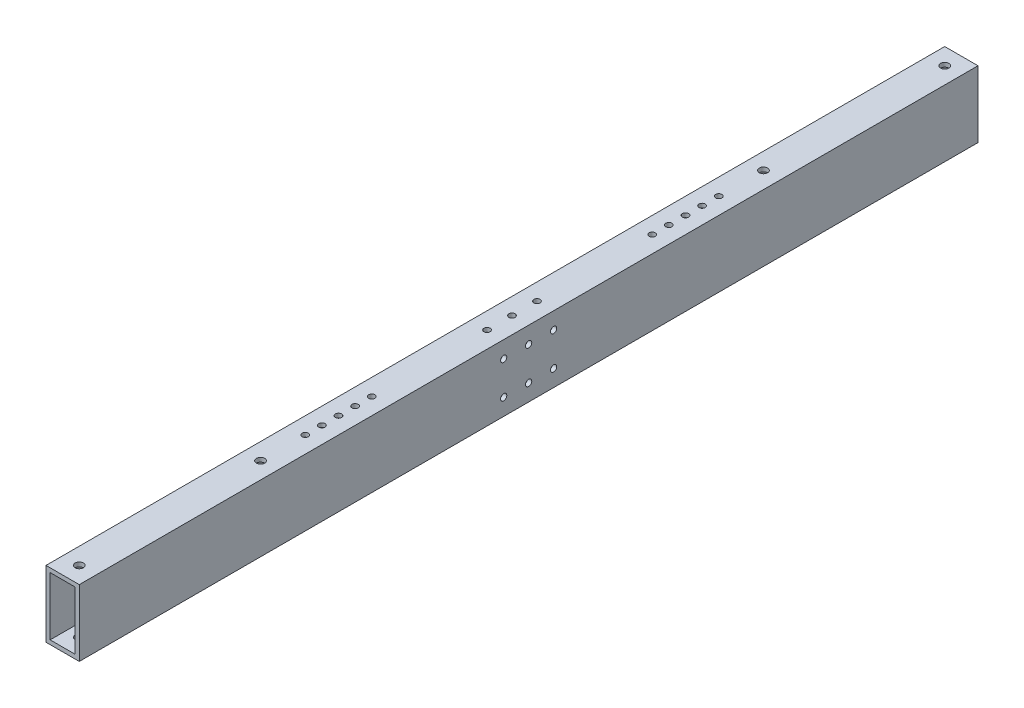
from build123d import *

# Parameters (mm, degrees)
SKETCH1_W           = 25.4
SKETCH1_H           = 50.8
SKETCH1_W_2         = 19.05
SKETCH1_H_2         = 44.45
BOSS_EXTRUDE1_DEPTH = 685.8
SKETCH2_R           = 3.175
SKETCH2_R_2         = 2.38125
CUT_EXTRUDE1_DEPTH  = 688.796168934
SKETCH3_R           = 2.38125
CUT_EXTRUDE2_DEPTH  = 3.175
SKETCH4_R           = 2.38125
CUT_EXTRUDE3_DEPTH  = 688.796168934


with BuildPart() as part:
    # Sketch1 → Boss-Extrude1 (new body)
    with BuildSketch(Plane.XY):
        Rectangle(SKETCH1_W, SKETCH1_H)
        Rectangle(SKETCH1_W_2, SKETCH1_H_2, mode=Mode.SUBTRACT)
    extrude(amount=BOSS_EXTRUDE1_DEPTH)

    # Sketch2 → Cut-Extrude1 (cut, through all)
    with BuildSketch(Plane(origin=(0, 25.4, 0), x_dir=(1, 0, 0), z_dir=(0, 1, 0))):
        with Locations(Location((0, -12.7, 0), (0, 0, 270))):
            Circle(SKETCH2_R)
        with Locations(Location((0, -151.012144, 0), (0, 0, 270))):
            Circle(SKETCH2_R)
        with Locations((0, -534.787856)):
            Circle(SKETCH2_R)
        with Locations((0, -673.1)):
            Circle(SKETCH2_R)
        with Locations(Location((0, -185.1062846, 0), (0, 0, 270))):
            Circle(SKETCH2_R_2)
        with Locations(Location((0, -197.8062846, 0), (0, 0, 270))):
            Circle(SKETCH2_R_2)
        with Locations(Location((0, -210.5062846, 0), (0, 0, 270))):
            Circle(SKETCH2_R_2)
        with Locations(Location((0, -223.2062846, 0), (0, 0, 270))):
            Circle(SKETCH2_R_2)
        with Locations(Location((0, -235.9062846, 0), (0, 0, 270))):
            Circle(SKETCH2_R_2)
        with Locations((0, -449.8937154)):
            Circle(SKETCH2_R_2)
        with Locations((0, -462.5937154)):
            Circle(SKETCH2_R_2)
        with Locations((0, -475.2937154)):
            Circle(SKETCH2_R_2)
        with Locations((0, -487.9937154)):
            Circle(SKETCH2_R_2)
        with Locations((0, -500.6937154)):
            Circle(SKETCH2_R_2)
    extrude(amount=-CUT_EXTRUDE1_DEPTH, mode=Mode.SUBTRACT)

    # Sketch3 → Cut-Extrude2 (cut)
    with BuildSketch(Plane(origin=(12.7, 0, 0), x_dir=(0, 0, -1), z_dir=(1, 0, 0))):
        with Locations((-361.95, -12.7)):
            Circle(SKETCH3_R)
        with Locations((-342.9, -12.7)):
            Circle(SKETCH3_R)
        with Locations(Location((-323.85, -12.7, 0), (0, 0, 180))):
            Circle(SKETCH3_R)
        with Locations((-323.85, 12.7)):
            Circle(SKETCH3_R)
        with Locations(Location((-361.95, 12.7, 0), (0, 0, 180))):
            Circle(SKETCH3_R)
        with Locations(Location((-342.9, 12.7, 0), (0, 0, 180))):
            Circle(SKETCH3_R)
    extrude(amount=-CUT_EXTRUDE2_DEPTH, mode=Mode.SUBTRACT)

    # Sketch4 → Cut-Extrude3 (cut, through all)
    with BuildSketch(Plane(origin=(0, -25.4, 0), x_dir=(-1, 0, 0), z_dir=(0, -1, 0))):
        with Locations(Location((0, -342.9, 0), (0, 0, 90))):
            Circle(SKETCH4_R)
        with Locations(Location((0, -361.95, 0), (0, 0, 90))):
            Circle(SKETCH4_R)
        with Locations(Location((0, -323.85, 0), (0, 0, 180))):
            Circle(SKETCH4_R)
    extrude(amount=-CUT_EXTRUDE3_DEPTH, mode=Mode.SUBTRACT)


solid = part.part
